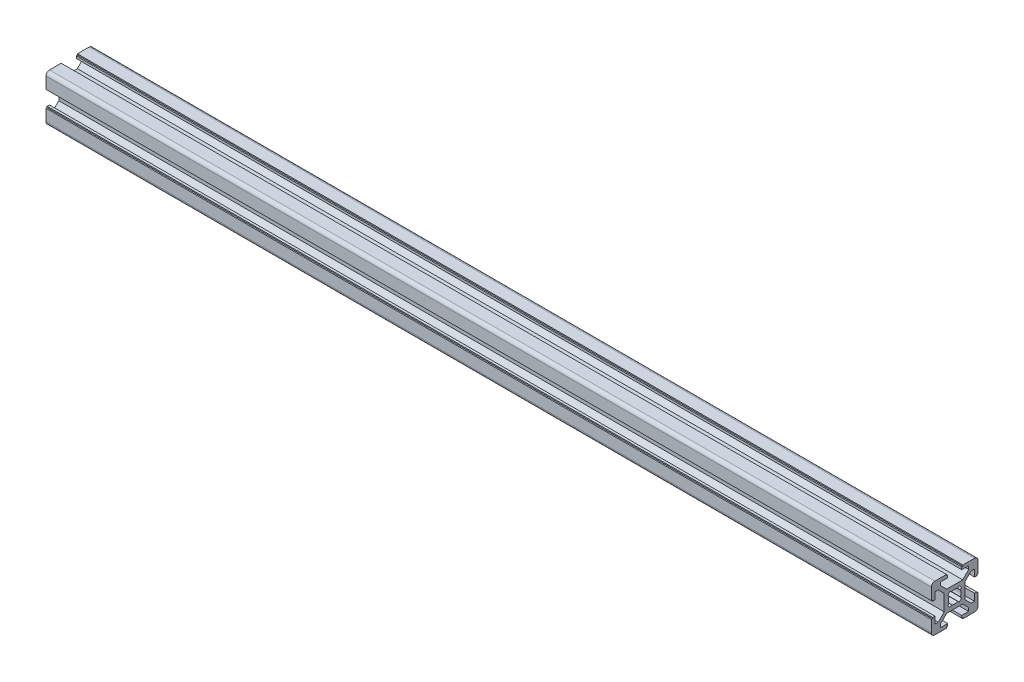
from build123d import *

# Parameters (mm, degrees)
BR_EXTRUDE_DEPTH      = 190
BR_EXTRUDE_DEPTH_BACK = 190


with BuildPart() as part:
    # Sketch2 → BR_Extrude (new, two sides: drawn at the far end of the back side and taken through both)
    with BuildSketch(Plane(origin=(0, 0, 0), x_dir=(0, 0, -1), z_dir=(1, 0, 0)).offset(-BR_EXTRUDE_DEPTH_BACK)):
        with BuildLine():
            Line((-7.060660172, -6), (-8.5, -6))
            Line((-8.5, -6), (-8.5, -3))
            Line((-8.5, -3), (-9.5, -3))
            Line((-9.5, -3), (-9.5, -3.5))
            Line((-9.5, -3.5), (-10, -3.5))
            Line((-10, -3.5), (-10, -8.5))
            ThreePointArc((-10, -8.5), (-9.560660172, -9.560660172), (-8.5, -10))
            Line((-8.5, -10), (-3.5, -10))
            Line((-3.5, -10), (-3.5, -9.5))
            Line((-3.5, -9.5), (-3, -9.5))
            Line((-3, -9.5), (-3, -8.5))
            Line((-3, -8.5), (-6, -8.5))
            Line((-6, -8.5), (-6, -7.060660172))
            Line((-6, -7.060660172), (-3.439339828, -4.5))
            Line((-3.439339828, -4.5), (3.439339828, -4.5))
            Line((3.439339828, -4.5), (6, -7.060660172))
            Line((6, -7.060660172), (6, -8.5))
            Line((6, -8.5), (3, -8.5))
            Line((3, -8.5), (3, -9.5))
            Line((3, -9.5), (3.5, -9.5))
            Line((3.5, -9.5), (3.5, -10))
            Line((3.5, -10), (8.5, -10))
            ThreePointArc((8.5, -10), (9.560660172, -9.560660172), (10, -8.5))
            Line((10, -8.5), (10, -3.5))
            Line((10, -3.5), (9.5, -3.5))
            Line((9.5, -3.5), (9.5, -3))
            Line((9.5, -3), (8.5, -3))
            Line((8.5, -3), (8.5, -6))
            Line((8.5, -6), (7.060660172, -6))
            Line((7.060660172, -6), (4.5, -3.439339828))
            Line((4.5, -3.439339828), (4.5, 3.439339828))
            Line((4.5, 3.439339828), (7.060660172, 6))
            Line((7.060660172, 6), (8.5, 6))
            Line((8.5, 6), (8.5, 3))
            Line((8.5, 3), (9.5, 3))
            Line((9.5, 3), (9.5, 3.5))
            Line((9.5, 3.5), (10, 3.5))
            Line((10, 3.5), (10, 8.5))
            ThreePointArc((10, 8.5), (9.560660172, 9.560660172), (8.5, 10))
            Line((8.5, 10), (3.5, 10))
            Line((3.5, 10), (3.5, 9.5))
            Line((3.5, 9.5), (3, 9.5))
            Line((3, 9.5), (3, 8.5))
            Line((3, 8.5), (6, 8.5))
            Line((6, 8.5), (6, 7.060660172))
            Line((6, 7.060660172), (3.439339828, 4.5))
            Line((3.439339828, 4.5), (-3.439339828, 4.5))
            Line((-3.439339828, 4.5), (-6, 7.060660172))
            Line((-6, 7.060660172), (-6, 8.5))
            Line((-6, 8.5), (-3, 8.5))
            Line((-3, 8.5), (-3, 9.5))
            Line((-3, 9.5), (-3.5, 9.5))
            Line((-3.5, 9.5), (-3.5, 10))
            Line((-3.5, 10), (-8.5, 10))
            ThreePointArc((-8.5, 10), (-9.560660172, 9.560660172), (-10, 8.5))
            Line((-10, 8.5), (-10, 3.5))
            Line((-10, 3.5), (-9.5, 3.5))
            Line((-9.5, 3.5), (-9.5, 3))
            Line((-9.5, 3), (-8.5, 3))
            Line((-8.5, 3), (-8.5, 6))
            Line((-8.5, 6), (-7.060660172, 6))
            Line((-7.060660172, 6), (-4.5, 3.439339828))
            Line((-4.5, 3.439339828), (-4.5, -3.439339828))
            Line((-4.5, -3.439339828), (-7.060660172, -6))
        make_face()
        with BuildLine():
            Line((-3.000174203, -1.949573265), (-2.435636363, -1.276783266))
            ThreePointArc((-2.435636363, -1.276783266), (-2.75, 0), (-2.435636363, 1.276783266))
            Line((-2.435636363, 1.276783266), (-3.000174203, 1.949573265))
            Line((-3.000174203, 1.949573265), (-1.949573265, 3.000174203))
            Line((-1.949573265, 3.000174203), (-1.276783266, 2.435636363))
            ThreePointArc((-1.276783266, 2.435636363), (0, 2.75), (1.276783266, 2.435636363))
            Line((1.276783266, 2.435636363), (1.949573265, 3.000174203))
            Line((1.949573265, 3.000174203), (3.000174203, 1.949573265))
            Line((3.000174203, 1.949573265), (2.435636363, 1.276783266))
            ThreePointArc((2.435636363, 1.276783266), (2.75, 0), (2.435636363, -1.276783266))
            Line((2.435636363, -1.276783266), (3.000174203, -1.949573265))
            Line((3.000174203, -1.949573265), (1.949573265, -3.000174203))
            Line((1.949573265, -3.000174203), (1.276783266, -2.435636363))
            ThreePointArc((1.276783266, -2.435636363), (0, -2.75), (-1.276783266, -2.435636363))
            Line((-1.276783266, -2.435636363), (-1.949573265, -3.000174203))
            Line((-1.949573265, -3.000174203), (-3.000174203, -1.949573265))
        make_face(mode=Mode.SUBTRACT)
    extrude(amount=BR_EXTRUDE_DEPTH + BR_EXTRUDE_DEPTH_BACK)


solid = part.part
